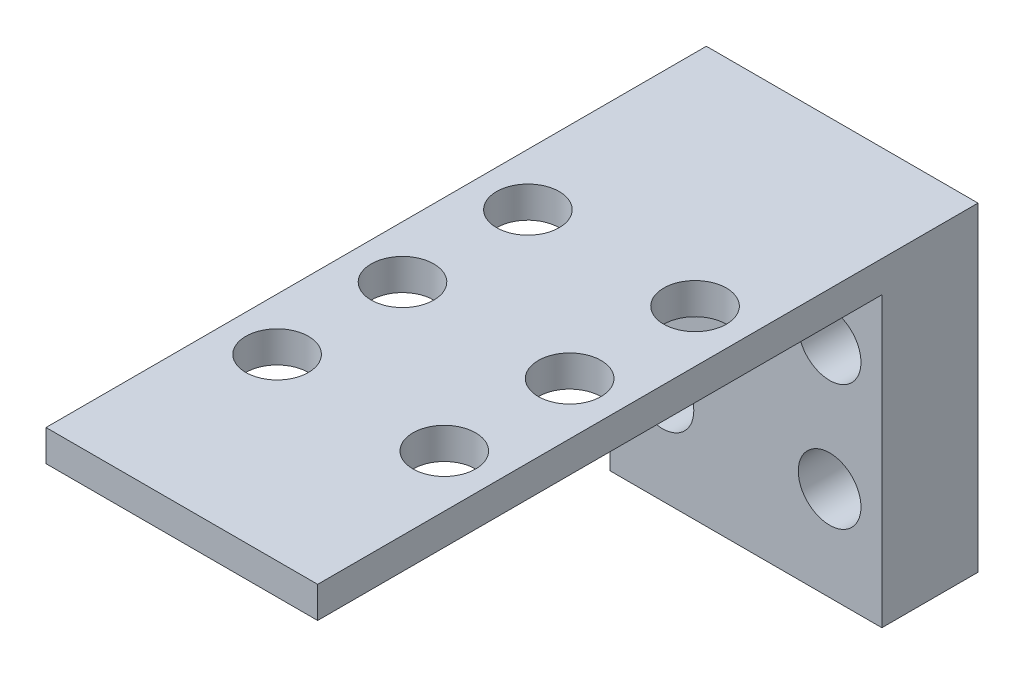
from build123d import *

# Parameters (mm, degrees)
SKETCH2_W           = 13
SKETCH2_H           = 12.3
SKETCH2_R           = 1.5
BOSS_EXTRUDE1_DEPTH = 4.6
SKETCH3_W           = 13
SKETCH3_H           = 27
SKETCH3_R           = 1.5
BOSS_EXTRUDE2_DEPTH = 10.603673126
SKETCH4_W           = 13
SKETCH4_H           = 12.3
CUT_EXTRUDE1_DEPTH  = 27
SKETCH5_W           = 13
SKETCH5_H           = 3
BOSS_EXTRUDE3_DEPTH = 4.6
SKETCH7_W           = 13
SKETCH7_H           = 27
CUT_EXTRUDE2_DEPTH  = 1.5


with BuildPart() as part:
    # Sketch2 → Boss-Extrude1 (new body)
    with BuildSketch(Plane.XY):
        with Locations((1, 1.453673126)):
            Rectangle(SKETCH2_W, SKETCH2_H)
        with Locations((-3, 5.803673126)):
            Circle(SKETCH2_R, mode=Mode.SUBTRACT)
        with Locations((-3, -0.196326874)):
            Circle(SKETCH2_R, mode=Mode.SUBTRACT)
        with Locations(Location((5, -0.196326874, 0), (0, 0, 180))):
            Circle(SKETCH2_R, mode=Mode.SUBTRACT)
        with Locations(Location((5, 5.803673126, 0), (0, 0, 180))):
            Circle(SKETCH2_R, mode=Mode.SUBTRACT)
    extrude(amount=BOSS_EXTRUDE1_DEPTH)

    # Sketch3 → Boss-Extrude2 (add)
    with BuildSketch(Plane(origin=(0, 0, 0), x_dir=(1, 0, 0), z_dir=(0, 1, 0))):
        with Locations((1, -18.1)):
            Rectangle(SKETCH3_W, SKETCH3_H)
        with Locations(Location((-3, -17.04, 0), (0, 0, 90))):
            Circle(SKETCH3_R, mode=Mode.SUBTRACT)
        with Locations(Location((-3, -23.04, 0), (0, 0, 90))):
            Circle(SKETCH3_R, mode=Mode.SUBTRACT)
        with Locations(Location((5, -23.04, 0), (0, 0, 90))):
            Circle(SKETCH3_R, mode=Mode.SUBTRACT)
        with Locations(Location((5, -17.04, 0), (0, 0, 90))):
            Circle(SKETCH3_R, mode=Mode.SUBTRACT)
        with Locations(Location((-3, -11.04, 0), (0, 0, 90))):
            Circle(SKETCH3_R, mode=Mode.SUBTRACT)
        with Locations(Location((5, -11.04, 0), (0, 0, 90))):
            Circle(SKETCH3_R, mode=Mode.SUBTRACT)
    extrude(amount=BOSS_EXTRUDE2_DEPTH)

    # Sketch4 → Cut-Extrude1 (cut)
    with BuildSketch(Plane.XY.offset(31.6)):
        with Locations((1, 1.453673126)):
            Rectangle(SKETCH4_W, SKETCH4_H)
    extrude(amount=-CUT_EXTRUDE1_DEPTH, mode=Mode.SUBTRACT)


with BuildPart() as cut_extrude1_piece_1:
    # of the separate pieces the step leaves, piece 1, a body of its own (cut_extrude1_pieces)
    add(part.part.solids().sort_by_distance((7.5, 10.603673126, 4.6))[0])



with BuildPart() as cut_extrude1_piece_2:
    # of the separate pieces the step leaves, piece 2, a body of its own (cut_extrude1_pieces)
    add(part.part.solids().sort_by_distance((-5.5, 7.603673126, 0))[0])


with BuildPart() as cut_extrude1_piece_1_1:
    add(cut_extrude1_piece_1.part)

    add(cut_extrude1_piece_2.part)  # Boss-Extrude3 merges Cut-Extrude1 piece 2
    # Sketch5 → Boss-Extrude3 (add)
    with BuildSketch(Plane(origin=(0, 0, 4.6), x_dir=(-1, 0, 0), z_dir=(0, 0, -1))):
        with Locations((-1, 9.103673126)):
            Rectangle(SKETCH5_W, SKETCH5_H)
    extrude(amount=BOSS_EXTRUDE3_DEPTH)

    # Sketch7 → Cut-Extrude2 (cut)
    with BuildSketch(Plane.XZ.offset(-7.603673126)):
        with Locations((1, 18.1)):
            Rectangle(SKETCH7_W, SKETCH7_H)
    extrude(amount=-CUT_EXTRUDE2_DEPTH, mode=Mode.SUBTRACT)


solid = cut_extrude1_piece_1_1.part
